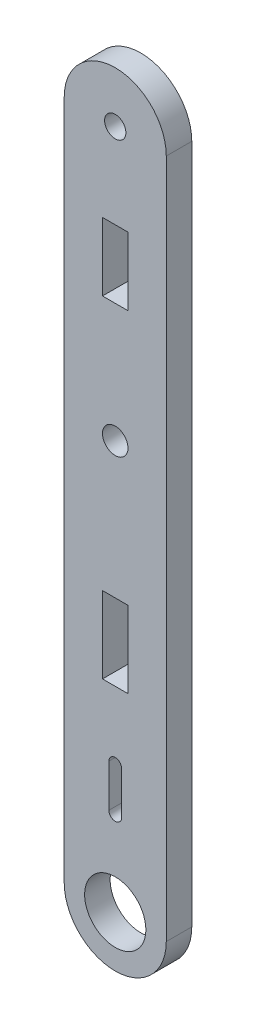
from build123d import *

# Parameters (mm, degrees)
SKETCH_3_R      = 3.6
SKETCH_3_R_2    = 1.500000002
SKETCH_3_R_3    = 1.25
SKETCH_3_W      = 3
SKETCH_3_H      = 8
SKETCH_3_H_2    = 9
EXTRUDE_1_DEPTH = 3


with BuildPart() as part:
    # 草圖3 → 填料-伸長1 (new body)
    with BuildSketch(Plane.XY):
        with BuildLine():
            Line((0.3003, 88.299976044), (0.3003, 8.299876044))
            ThreePointArc((0.3003, 8.299876044), (6.300299999, 2.299876044), (12.3003, 8.299876044))
            Line((12.3003, 8.299876044), (12.3003, 88.299876044))
            ThreePointArc((12.3003, 88.299876044), (6.30035, 94.299926044), (0.3003, 88.299976044))
        make_face()
        with Locations((6.300299999, 8.299876043)):
            Circle(SKETCH_3_R, mode=Mode.SUBTRACT)
        with Locations((6.300300002, 56.299976042)):
            Circle(SKETCH_3_R_2, mode=Mode.SUBTRACT)
        with Locations((6.300299998, 88.299876042)):
            Circle(SKETCH_3_R_3, mode=Mode.SUBTRACT)
        with BuildLine():
            Line((5.550300003, 18.299879855), (5.550300003, 23.299876041))
            ThreePointArc((5.550300003, 23.299876041), (6.300299999, 24.049917709), (7.050299997, 23.299876041))
            Line((7.050299997, 23.299876041), (7.050299997, 18.299879855))
            ThreePointArc((7.050299997, 18.299879855), (6.3003, 17.549879857), (5.550300003, 18.299879855))
        make_face(mode=Mode.SUBTRACT)
        with Locations((6.3003, 74.299876044)):
            Rectangle(SKETCH_3_W, SKETCH_3_H, mode=Mode.SUBTRACT)
        with Locations((6.3003, 35.799876044)):
            Rectangle(SKETCH_3_W, SKETCH_3_H_2, mode=Mode.SUBTRACT)
    extrude(amount=EXTRUDE_1_DEPTH)


solid = part.part
